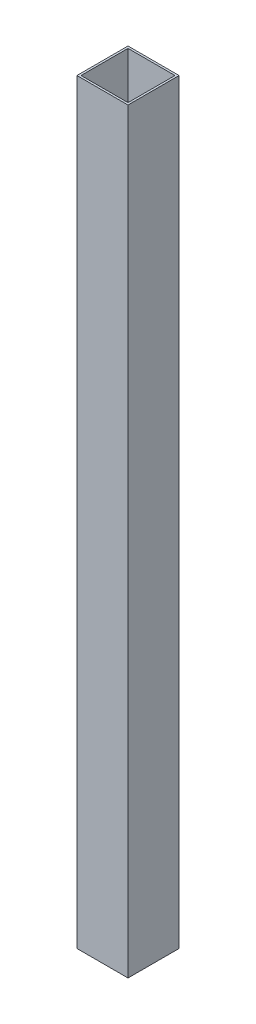
from build123d import *

# Parameters (mm, degrees)
SKETCH1_W           = 50
SKETCH1_H           = 50
BOSS_EXTRUDE1_DEPTH = 740
SHELL1_T            = -2


with BuildPart() as part:
    # Sketch1 → Boss-Extrude1 (new body)
    with BuildSketch(Plane(origin=(0, 0, 0), x_dir=(1, 0, 0), z_dir=(0, 1, 0))):
        Rectangle(SKETCH1_W, SKETCH1_H)
    extrude(amount=BOSS_EXTRUDE1_DEPTH)

    # Shell1
    shell1_openings = [part.faces().sort_by_distance(p)[0] for p in [
        (0, 740, 0),
    ]]
    offset(amount=SHELL1_T, openings=shell1_openings, kind=Kind.INTERSECTION)


solid = part.part
